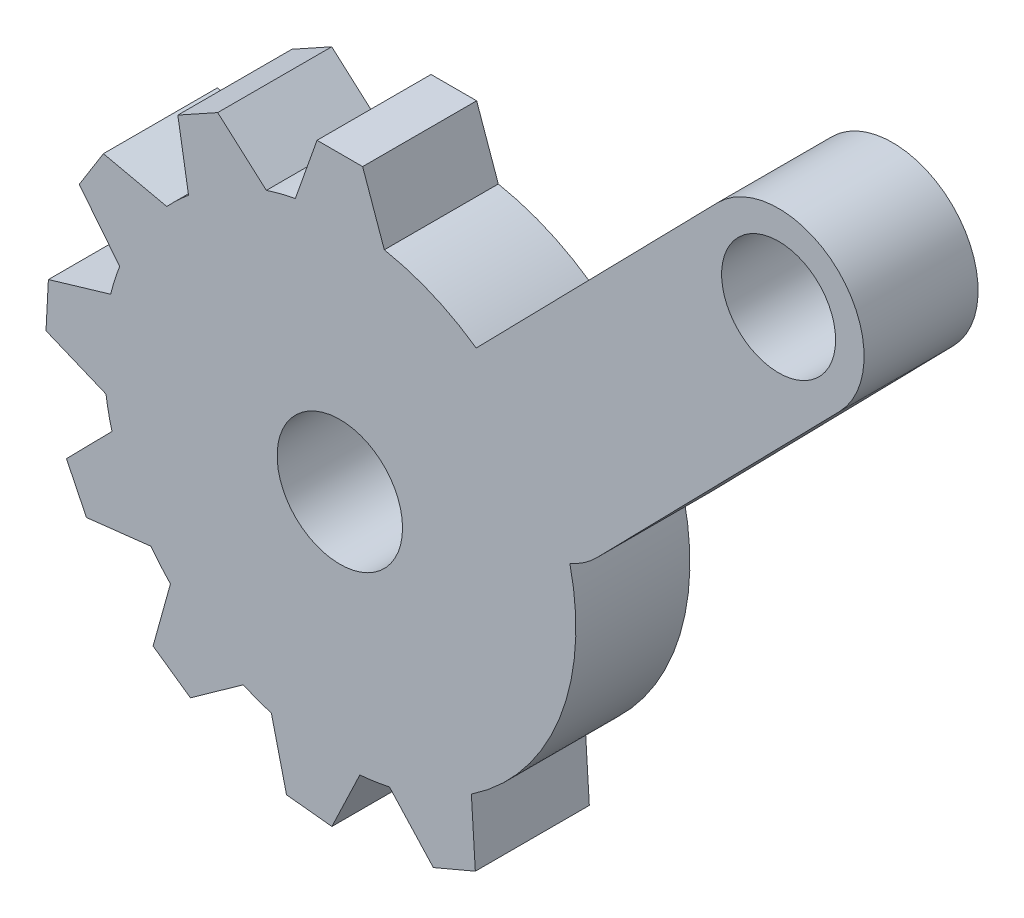
from build123d import *

# Parameters (mm, degrees)
CROQUIS1_R               = 5
SALIENTE_EXTRUIR5_DEPTH  = 10
MATRIZC4_COUNT           = 8
MATRIZC4_ANGLE           = 203
CROQUIS9_R               = 5
SALIENTE_EXTRUIR6_DEPTH  = 10
SALIENTE_EXTRUIR7_START  = -10
CROQUIS11_R              = 5
SALIENTE_EXTRUIR7_DEPTH  = 10
CORTAR_EXTRUIR2_DEPTH    = 10
SALIENTE_EXTRUIR9_DEPTH  = 10
CROQUIS15_R              = 6
CORTAR_EXTRUIR4_DEPTH    = 10
ESCALA1_SCALE            = 0.75
CROQUIS16_R              = 4.5
CROQUIS16_R_2            = 4.125
SALIENTE_EXTRUIR12_DEPTH = 7.5


with BuildPart() as part:
    # Croquis1 → Saliente-Extruir5 (new body)
    with BuildSketch(Plane.XY):
        with BuildLine():
            Line((-2, 25.706379875), (-3.901693271, 20.335460584))
            ThreePointArc((-3.901693271, 20.335460584), (0, -20.706379875), (3.901693271, 20.335460584))
            Line((3.901693271, 20.335460584), (2, 25.706379875))
            Line((2, 25.706379875), (-2, 25.706379875))
        make_face()
        Circle(CROQUIS1_R, mode=Mode.SUBTRACT)
    saliente_extruir5 = extrude(amount=SALIENTE_EXTRUIR5_DEPTH)

    # MatrizC4: Saliente-Extruir5 ×8 about axis
    matrizc4_axis = Axis((0, 0, 0), (0, 0, 1))
    for i in range(1, MATRIZC4_COUNT):
        add(saliente_extruir5.rotate(matrizc4_axis, i * MATRIZC4_ANGLE / (MATRIZC4_COUNT - 1)))

    # Croquis9 → Saliente-Extruir6 (add)
    with BuildSketch(Plane.XY.offset(10)):
        with BuildLine():
            Line((11.839442553, 16.776986757), (33.130186467, 38.526068093))
            ThreePointArc((33.130186467, 38.526068093), (43.736186818, 38.639012949), (43.849131674, 28.033012597))
            Line((43.849131674, 28.033012597), (22.558387761, 6.283931261))
            ThreePointArc((22.558387761, 6.283931261), (11.952387409, 6.170986405), (11.839442553, 16.776986757))
        make_face()
        with Locations((38.48965907, 33.279540345)):
            Circle(CROQUIS9_R, mode=Mode.SUBTRACT)
    extrude(amount=-SALIENTE_EXTRUIR6_DEPTH)

    # Croquis11 → Saliente-Extruir7 (add)
    with BuildSketch(Plane.XY.offset(10).offset(SALIENTE_EXTRUIR7_START)):
        Circle(CROQUIS11_R)
    extrude(amount=SALIENTE_EXTRUIR7_DEPTH)

    # Croquis12 → Cortar-Extruir2 (cut)
    with BuildSketch(Plane.XY.offset(10)):
        with BuildLine():
            ThreePointArc((-3.771236166, 4.666666667), (0, -6), (3.771236166, 4.666666667))
            ThreePointArc((3.771236166, 4.666666667), (0, 10), (-3.771236166, 4.666666667))
        make_face()
    extrude(amount=-CORTAR_EXTRUIR2_DEPTH, mode=Mode.SUBTRACT)

    # Croquis13 → Saliente-Extruir9 (add)
    with BuildSketch(Plane.XY.offset(10)):
        with BuildLine():
            ThreePointArc((3.771236166, 4.666666667), (0, 10), (-3.771236166, 4.666666667))
            ThreePointArc((-3.771236166, 4.666666667), (0, -6), (3.771236166, 4.666666667))
        make_face()
    extrude(amount=-SALIENTE_EXTRUIR9_DEPTH)

    # Croquis15 → Cortar-Extruir4 (cut)
    with BuildSketch(Plane.XY.offset(10)):
        Circle(CROQUIS15_R)
    extrude(amount=-CORTAR_EXTRUIR4_DEPTH, mode=Mode.SUBTRACT)


with BuildPart() as part_1:
    # Escala1: scaled about (5.677071508, 5.296040102, 5)
    add(part.part.scale(ESCALA1_SCALE).moved(Location((1.419267877, 1.324010026, 1.25))))

    # Croquis16 → Saliente-Extruir12 (add)
    with BuildSketch(Plane.XY.offset(8.75)):
        with Locations((1.419267877, 1.324010026)):
            Circle(CROQUIS16_R)
        with Locations((1.419267877, 1.324010026)):
            Circle(CROQUIS16_R_2, mode=Mode.SUBTRACT)
    extrude(amount=-SALIENTE_EXTRUIR12_DEPTH)


solid = part_1.part
